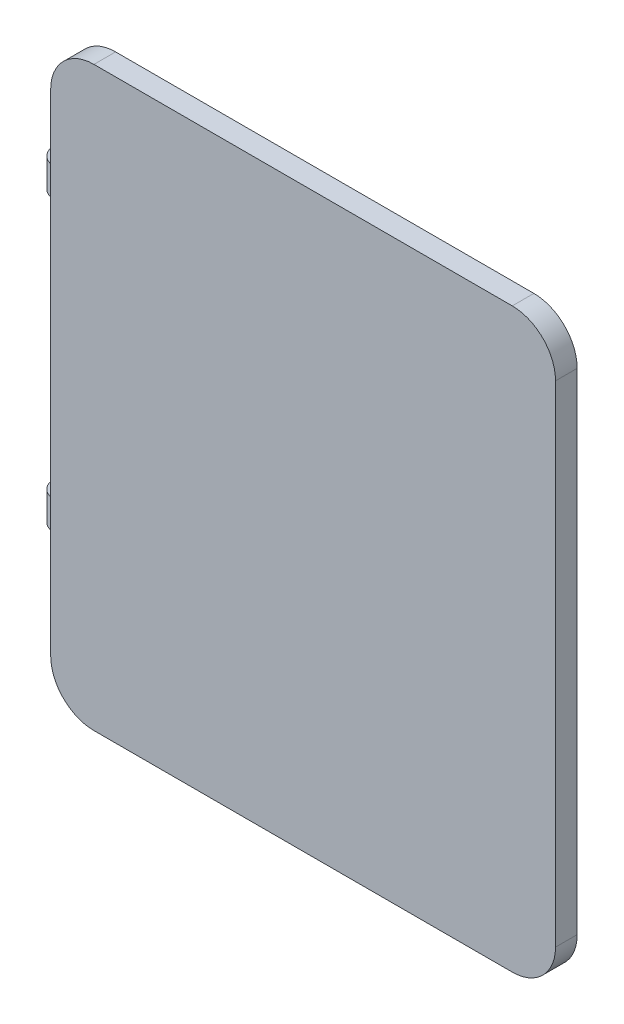
from build123d import *

# Parameters (mm, degrees)
SKETCH1_W                = 350
SKETCH1_H                = 400
BOSS_EXTRUDE1_DEPTH      = 15
BOSS_EXTRUDE2_DEPTH      = 10
BOSS_EXTRUDE2_DEPTH_BACK = 10
SKETCH3_R                = 12.5
SKETCH3_R_2              = 10
BOSS_EXTRUDE3_DEPTH      = 10
BOSS_EXTRUDE3_DEPTH_BACK = 10
SKETCH4_R                = 12.5
SKETCH4_R_2              = 10
CUT_EXTRUDE1_DEPTH       = 74
SKETCH6_R                = 7.5
BOSS_EXTRUDE4_DEPTH      = 10
BOSS_EXTRUDE5_DEPTH      = 5


with BuildPart() as part:
    # Sketch1 → Boss-Extrude1 (new body)
    with BuildSketch(Plane.XY):
        Rectangle(SKETCH1_W, SKETCH1_H)
    extrude(amount=BOSS_EXTRUDE1_DEPTH)

    # Sketch3 → Boss-Extrude2 (add, two sides: drawn at the far end of the back side and taken through both)
    # profile 1 of 2: a face of its own
    with BuildSketch(Plane(origin=(0, 100, 0), x_dir=(1, 0, 0), z_dir=(0, 1, 0)).offset(-BOSS_EXTRUDE2_DEPTH_BACK)):
        with BuildLine():
            ThreePointArc((-175, 12.5), (-178.661165235, 3.661165235), (-187.5, 0))
            Line((-187.5, 0), (-127.5, 0))
            Line((-127.5, 0), (-182.508319468, 23.960066556))
            ThreePointArc((-182.508319468, 23.960066556), (-177.04423588, 19.350328216), (-175, 12.5))
        make_face()
    # profile 2 of 2: a face of its own
    with BuildSketch(Plane(origin=(0, 100, 0), x_dir=(1, 0, 0), z_dir=(0, 1, 0)).offset(-BOSS_EXTRUDE2_DEPTH_BACK)):
        with Locations((-187.5, 12.5)):
            Circle(SKETCH3_R)
        with Locations(Location((-187.5, 12.5, 0), (0, 0, 270))):
            Circle(SKETCH3_R_2, mode=Mode.SUBTRACT)
    extrude(amount=BOSS_EXTRUDE2_DEPTH + BOSS_EXTRUDE2_DEPTH_BACK)

    # Sketch4 → Boss-Extrude3 (add, two sides: drawn at the far end of the back side and taken through both)
    # profile 1 of 2: a face of its own
    with BuildSketch(Plane(origin=(0, -100, 0), x_dir=(1, 0, 0), z_dir=(0, 1, 0)).offset(-BOSS_EXTRUDE3_DEPTH_BACK)):
        with Locations((-187.5, 12.5)):
            Circle(SKETCH4_R)
        with Locations(Location((-187.5, 12.5, 0), (0, 0, 270))):
            Circle(SKETCH4_R_2, mode=Mode.SUBTRACT)
    # profile 2 of 2: a face of its own
    with BuildSketch(Plane(origin=(0, -100, 0), x_dir=(1, 0, 0), z_dir=(0, 1, 0)).offset(-BOSS_EXTRUDE3_DEPTH_BACK)):
        with BuildLine():
            Line((-127.5, 0), (-182.508319468, 23.960066556))
            ThreePointArc((-182.508319468, 23.960066556), (-177.04423588, 19.350328216), (-175, 12.5))
            ThreePointArc((-175, 12.5), (-178.661165235, 3.661165235), (-187.5, 0))
            Line((-187.5, 0), (-127.5, 0))
        make_face()
    extrude(amount=BOSS_EXTRUDE3_DEPTH + BOSS_EXTRUDE3_DEPTH_BACK)

    # Sketch5 → Cut-Extrude1 (cut)
    with BuildSketch(Plane(origin=(0, 0, 0), x_dir=(-1, 0, 0), z_dir=(0, 0, -1))):
        with BuildLine():
            Line((-175, 200), (-175, 170))
            ThreePointArc((-175, 170), (-166.213203436, 191.213203436), (-145, 200))
            Line((-145, 200), (-175, 200))
        make_face()
        with BuildLine():
            ThreePointArc((-145, -200), (-166.213203436, -191.213203436), (-175, -170))
            Line((-175, -170), (-175, -200))
            Line((-175, -200), (-145, -200))
        make_face()
        with BuildLine():
            ThreePointArc((175, -170), (166.213203436, -191.213203436), (145, -200))
            Line((145, -200), (175, -200))
            Line((175, -200), (175, -170))
        make_face()
        with BuildLine():
            Line((175, 200), (145, 200))
            ThreePointArc((145, 200), (166.213203436, 191.213203436), (175, 170))
            Line((175, 170), (175, 200))
        make_face()
    extrude(amount=-CUT_EXTRUDE1_DEPTH, mode=Mode.SUBTRACT)

    # Sketch6 → Boss-Extrude4 (add)
    with BuildSketch(Plane(origin=(0, 0, 0), x_dir=(-1, 0, 0), z_dir=(0, 0, -1))):
        with Locations(Location((-145, 40, 0), (0, 0, 180))):
            Circle(SKETCH6_R)
        with Locations(Location((-145, -40, 0), (0, 0, 180))):
            Circle(SKETCH6_R)
    extrude(amount=BOSS_EXTRUDE4_DEPTH)

    # Sketch7 → Boss-Extrude5 (add)
    with BuildSketch(Plane(origin=(0, 0, -10), x_dir=(-1, 0, 0), z_dir=(0, 0, -1))):
        with BuildLine():
            Line((-150, 50), (-140, 50))
            ThreePointArc((-140, 50), (-136.464466094, 48.535533906), (-135, 45))
            Line((-135, 45), (-135, -45))
            ThreePointArc((-135, -45), (-136.464466094, -48.535533906), (-140, -50))
            Line((-140, -50), (-150, -50))
            ThreePointArc((-150, -50), (-153.535533906, -48.535533906), (-155, -45))
            Line((-155, -45), (-155, 45))
            ThreePointArc((-155, 45), (-153.535533906, 48.535533906), (-150, 50))
        make_face()
    extrude(amount=BOSS_EXTRUDE5_DEPTH)


solid = part.part
